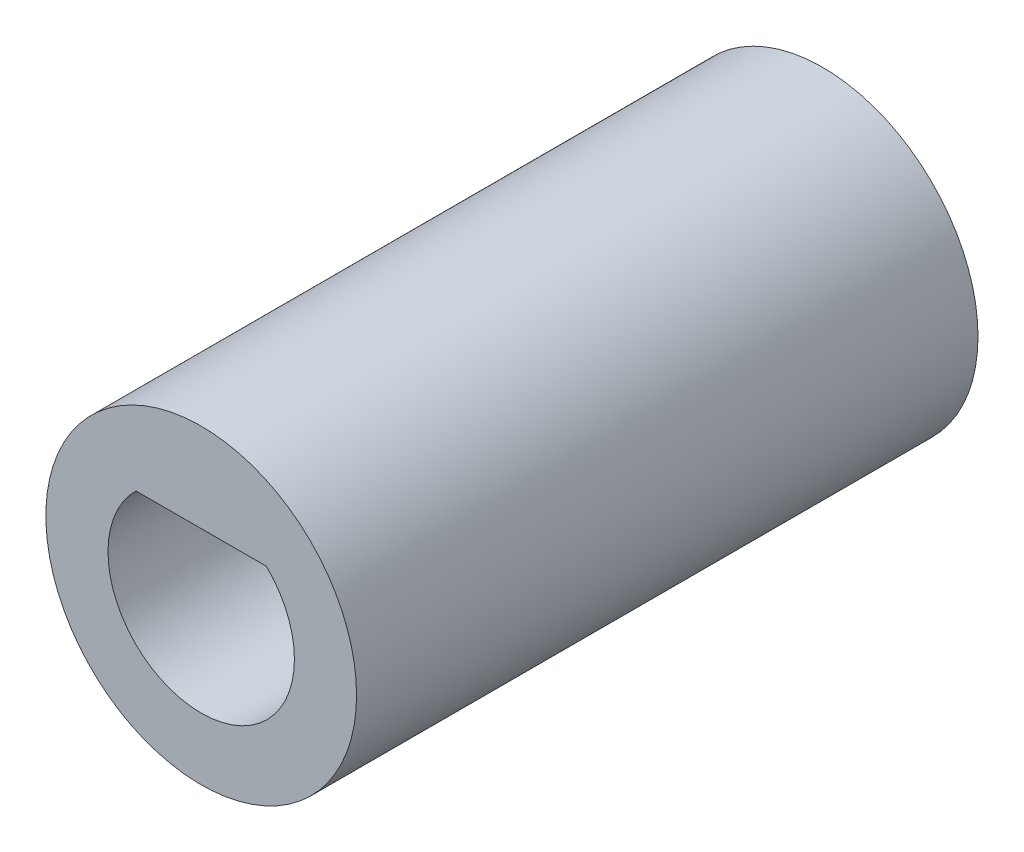
from build123d import *

# Parameters (mm, degrees)
SKETCH_1_R          = 3.5
EXTRUDE_1_DEPTH     = 14
CUT_EXTRUDE_1_DEPTH = 7
SKETCH_3_W          = 1.9
SKETCH_3_H          = 1.5
SKETCH_3_W_2        = 1.5
SKETCH_3_H_2        = 1.9
CUT_EXTRUDE_2_DEPTH = 6
FILLET_2_R          = 0.1


with BuildPart() as part:
    # 草图1 → 凸台-拉伸1 (new body)
    with BuildSketch(Plane.XY):
        Circle(SKETCH_1_R)
    extrude(amount=EXTRUDE_1_DEPTH)

    # 草图2 → 切除-拉伸1 (cut)
    with BuildSketch(Plane.XY.offset(14)):
        with BuildLine():
            Line((1.469693846, 1.5), (-1.469693846, 1.5))
            ThreePointArc((-1.469693846, 1.5), (-0.8135241, -1.936021317), (2.1, 0))
            ThreePointArc((2.1, 0), (1.936021317, 0.8135241), (1.469693846, 1.5))
        make_face()
    extrude(amount=-CUT_EXTRUDE_1_DEPTH, mode=Mode.SUBTRACT)

    # 草图3 → 切除-拉伸2 (cut)
    with BuildSketch(Plane(origin=(0, 0, 0), x_dir=(-1, 0, 0), z_dir=(0, 0, -1))):
        with Locations((0, -1.7)):
            Rectangle(SKETCH_3_W, SKETCH_3_H)
        with Locations((1.7, 0)):
            Rectangle(SKETCH_3_W_2, SKETCH_3_H_2)
        Rectangle(SKETCH_3_W, SKETCH_3_H_2)
        with Locations((-1.7, 0)):
            Rectangle(SKETCH_3_W_2, SKETCH_3_H_2)
        with Locations((0, 1.7)):
            Rectangle(SKETCH_3_W, SKETCH_3_H)
    extrude(amount=-CUT_EXTRUDE_2_DEPTH, mode=Mode.SUBTRACT)

    # 圆角2
    fillet_2_edges = [part.edges().sort_by_distance(p)[0] for p in [
        (-0.95, -1.7, 6),
        (-0.95, -0.95, 3),
        (0, -2.45, 0),
        (-0.95, -2.45, 3),
        (0.95, -1.7, 0),
        (0.95, -2.45, 3),
        (1.7, -0.95, 6),
        (0.95, -0.95, 3),
        (2.45, 0, 0),
        (2.45, -0.95, 3),
        (1.7, 0.95, 0),
        (2.45, 0.95, 3),
        (0.95, 1.7, 0),
        (0.95, 0.95, 3),
        (0, 2.45, 6),
        (0.95, 2.45, 3),
        (-0.95, 1.7, 6),
        (-0.95, 2.45, 3),
        (-1.7, 0.95, 0),
        (-0.95, 0.95, 3),
        (-2.45, 0, 6),
        (-2.45, 0.95, 3),
        (-1.7, -0.95, 6),
        (-2.45, -0.95, 3),
        (0, -2.45, 6),
        (0.95, -1.7, 6),
        (2.45, 0, 6),
        (1.7, 0.95, 6),
        (0.95, 1.7, 6),
        (-1.7, 0.95, 6),
        (-0.95, -1.7, 0),
        (-1.7, -0.95, 0),
        (-2.45, 0, 0),
        (-0.95, 1.7, 0),
        (0, 2.45, 0),
        (1.7, -0.95, 0),
    ]]
    fillet(fillet_2_edges, radius=FILLET_2_R)


solid = part.part
